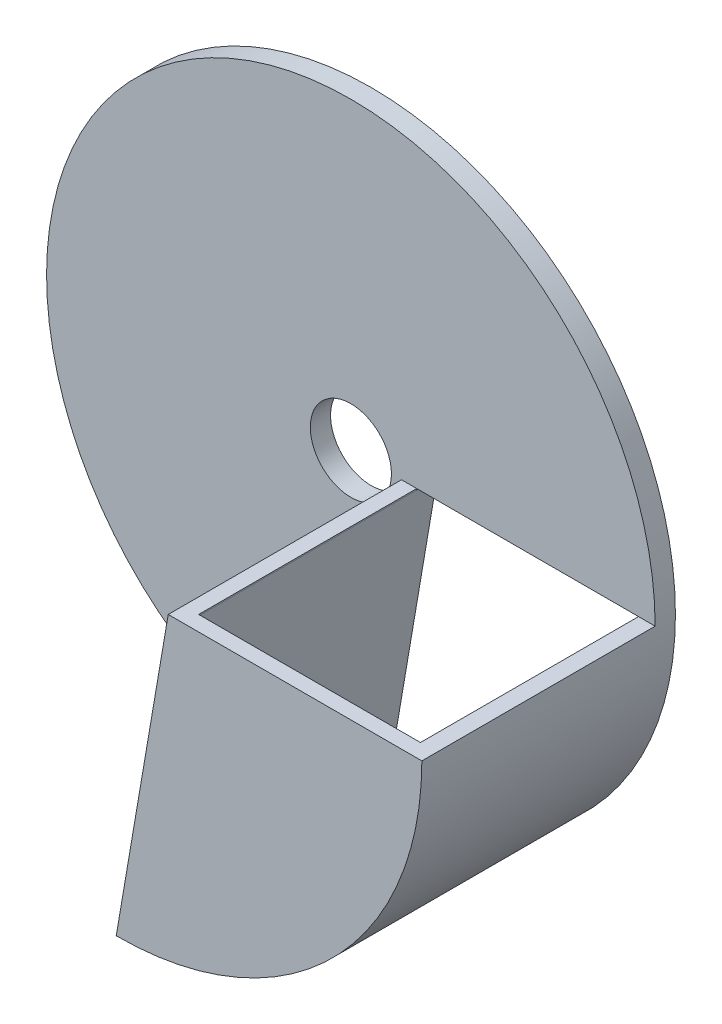
from build123d import *
from build123d.topology import SkipClean

# Parameters (mm, degrees)
SKETCH1_R           = 60
SKETCH1_R_2         = 8
BOSS_EXTRUDE1_DEPTH = 4
BOSS_EXTRUDE2_DEPTH = 50
CUT_EXTRUDE1_DEPTH  = 47
SKETCH3_W           = 43.731073279
SKETCH3_H           = 43
CUT_EXTRUDE3_DEPTH  = 3


with BuildPart() as part:
    # Sketch1 → Boss-Extrude1 (new body)
    with BuildSketch(Plane.XY):
        Circle(SKETCH1_R)
        with BuildLine():
            Line((0.265819003, -56.90851166), (9.990859575, 0))
            Line((9.990859575, 0), (56.710923629, 0))
            ThreePointArc((56.710923629, 0), (40.206313594, -40.076778693), (0.265819003, -56.90851166))
        make_face(mode=Mode.SUBTRACT)
        Circle(SKETCH1_R_2, mode=Mode.SUBTRACT)
    extrude(amount=BOSS_EXTRUDE1_DEPTH)

    # Sketch1<3> → Boss-Extrude2 (add)
    with SkipClean():  # the faces are left unmerged after this step: merging them gives an invalid solid
        with BuildSketch(Plane.XY):
            with BuildLine():
                Line((60, 0), (9.990859575, 0))
                Line((9.990859575, 0), (-0.26238441, -59.999426284))
                ThreePointArc((-0.26238441, -59.999426284), (42.333538332, -42.519072571), (60, 0))
            make_face()
        extrude(amount=BOSS_EXTRUDE2_DEPTH)

    # Sketch1<6> → Cut-Extrude1 (cut)
    with SkipClean():  # the faces are left unmerged after this step: merging them gives an invalid solid
        with BuildSketch(Plane.XY):
            with BuildLine():
                ThreePointArc((3.3276834, -56.800985601), (41.2704357, -38.974638406), (56.710923629, 0))
                Line((56.710923629, 0), (13.034348947, 0))
                Line((13.034348947, 0), (12.521681846, -3))
                Line((12.521681846, -3), (3.3276834, -56.800985601))
            make_face()
        extrude(amount=CUT_EXTRUDE1_DEPTH, mode=Mode.SUBTRACT)

    # Sketch3 → Cut-Extrude3 (cut)
    with SkipClean():  # the faces are left unmerged after this step: merging them gives an invalid solid
        with BuildSketch(Plane(origin=(0, 0, 0), x_dir=(1, 0, 0), z_dir=(0, 1, 0))):
            with Locations((34.856396215, -25.5)):
                Rectangle(SKETCH3_W, SKETCH3_H)
        extrude(amount=-CUT_EXTRUDE3_DEPTH, mode=Mode.SUBTRACT)


solid = part.part
